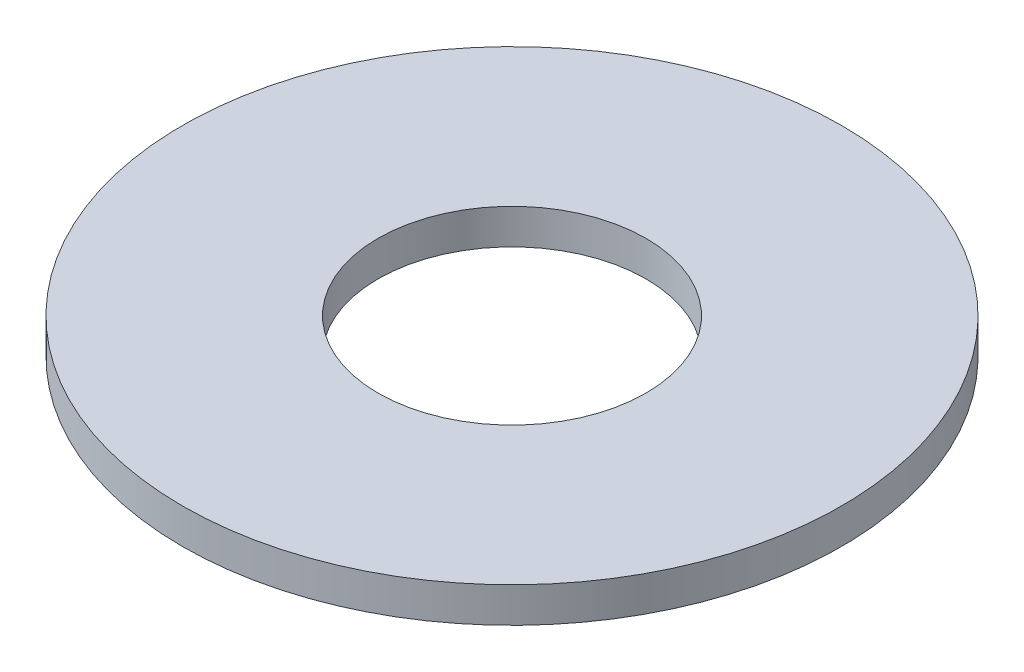
from build123d import *

# Parameters (mm, degrees)
SKETCH2_R           = 18.75
SKETCH2_R_2         = 7.625
BOSS_EXTRUDE1_DEPTH = 2


with BuildPart() as part:
    # Sketch2 → Boss-Extrude1 (new body)
    with BuildSketch(Plane(origin=(0, 0, 0), x_dir=(1, 0, 0), z_dir=(0, 1, 0))):
        with Locations(Location((0, 0, 0), (0, 0, 270))):
            Circle(SKETCH2_R)
        with Locations(Location((0, 0, 0), (0, 0, 270))):
            Circle(SKETCH2_R_2, mode=Mode.SUBTRACT)
    extrude(amount=BOSS_EXTRUDE1_DEPTH)


solid = part.part
